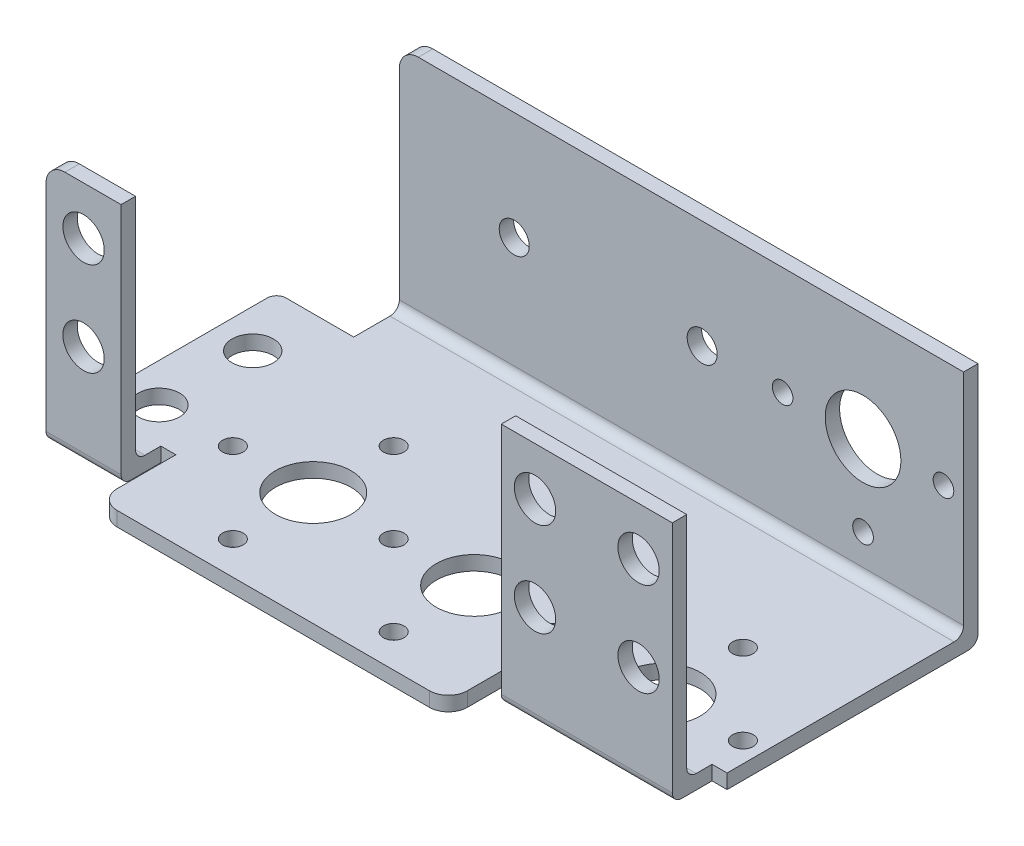
from build123d import *

# Parameters (mm, degrees)
SKETCH1_W                = 114.3
SKETCH1_H                = 34.72
BOSS_EXTRUDE1_DEPTH      = 1.524
SKETCH2_R                = 2.184
SKETCH2_W                = 8.15
SKETCH2_H                = 6.35
CUT_EXTRUDE1_DEPTH       = 1.524
SKETCH3_R                = 4
CUT_EXTRUDE2_DEPTH       = 50
SKETCH4_R                = 1.09
CUT_EXTRUDE3_DEPTH       = 50
CIRPATTERN1_COUNT        = 4
MIRROR2_COPY_1_SKETCH_R  = 1.09
MIRROR2_COPY_1_DEPTH     = 50
MIRROR2_COPY_2_SKETCH_R  = 1.09
MIRROR2_COPY_2_DEPTH     = 50
MIRROR2_COPY_3_SKETCH_R  = 1.09
MIRROR2_COPY_3_DEPTH     = 50
SKETCH7_R                = 4
CUT_EXTRUDE4_DEPTH       = 100
SKETCH8_R                = 1.09
CUT_EXTRUDE5_DEPTH       = 100
CIRPATTERN2_COUNT        = 4
SKETCH9_W                = 7.9375
SKETCH9_H                = 1.524
BOSS_EXTRUDE2_DEPTH      = 24.2
SKETCH10_W               = 98
SKETCH10_H               = 1.524
SKETCH10_W_2             = 18.075
BOSS_EXTRUDE3_DEPTH      = 24.2
SKETCH11_R               = 2.1844
CUT_EXTRUDE6_DEPTH       = 24.2
SKETCH12_R               = 2.1844
CUT_EXTRUDE8_DEPTH       = 24.2
FILLET1_R                = 1
SKETCH13_R               = 1.5875
CUT_EXTRUDE9_DEPTH       = 24.2
FILLET2_R                = 2
SKETCH14_R               = 4
CUT_EXTRUDE10_DEPTH      = 24.2
SKETCH15_R               = 1.09
CUT_EXTRUDE11_DEPTH      = 24.2
CIRPATTERN3_COUNT        = 4
CUT_EXTRUDE13_DEPTH      = 30
CUT_EXTRUDE13_DEPTH_BACK = 19
SKETCH18_W               = 48.234659097
SKETCH18_H               = 11.142394616
SKETCH18_H_2             = 30.082733934


with BuildPart() as part:
    # Sketch1 → Boss-Extrude1 (new body)
    with BuildSketch(Plane(origin=(0, 0, 0), x_dir=(1, 0, 0), z_dir=(0, 1, 0))):
        Rectangle(SKETCH1_W, SKETCH1_H)
    extrude(amount=BOSS_EXTRUDE1_DEPTH)

    # Sketch2 → Cut-Extrude1 (cut)
    with BuildSketch(Plane(origin=(0, 1.524, 0), x_dir=(1, 0, 0), z_dir=(0, 1, 0))):
        with Locations(Location((-53.075, 4.41, 0), (0, 0, 270))):
            Circle(SKETCH2_R)
        with Locations(Location((-53.075, -5.5, 0), (0, 0, 270))):
            Circle(SKETCH2_R)
        with Locations((-53.075, 14.185)):
            Rectangle(SKETCH2_W, SKETCH2_H)
        Polygon((-57.15, -13.36), (-49.2125, -13.36), (-49.2125, -9.16), (-47.625, -9.16), (-47.625, -13.36), (-47.625, -17.36), (-57.15, -17.36), align=None)
        Polygon((-10.625, -13.36), (-10.625, -9.16), (-9.0375, -9.16), (-9.0375, -13.36), (0, -13.36), (0, -17.36), (-10.625, -17.36), align=None)
    cut_extrude1 = extrude(amount=-CUT_EXTRUDE1_DEPTH, mode=Mode.SUBTRACT)

    # Mirror1: Cut-Extrude1 across plane
    add(cut_extrude1.mirror(Plane(origin=(0, 0, 0), x_dir=(0, 0, 1), z_dir=(1, 0, 0))), mode=Mode.SUBTRACT)

    # Sketch3 → Cut-Extrude2 (cut, symmetric)
    with BuildSketch(Plane(origin=(0, 1.524, 0), x_dir=(1, 0, 0), z_dir=(0, 1, 0))):
        with Locations(Location((-36.9062, -5.36, 0), (0, 0, 90))):
            Circle(SKETCH3_R)
    cut_extrude2 = extrude(amount=CUT_EXTRUDE2_DEPTH, both=True, mode=Mode.SUBTRACT)

    # Sketch4 → Cut-Extrude3 (cut, symmetric)
    with BuildSketch(Plane(origin=(0, 1.524, 0), x_dir=(1, 0, 0), z_dir=(0, 1, 0))):
        with Locations(Location((-36.9062, 3.14, 0), (0, 0, 90))):
            Circle(SKETCH4_R)
    cut_extrude3 = extrude(amount=CUT_EXTRUDE3_DEPTH, both=True, mode=Mode.SUBTRACT)

    # CirPattern1: Cut-Extrude3 ×4 about axis
    cirpattern1_axis = Axis((-36.9062, 0, 5.36), (0, 1, 0))
    for i in range(1, CIRPATTERN1_COUNT):
        add(cut_extrude3.rotate(cirpattern1_axis, i * 360 / CIRPATTERN1_COUNT), mode=Mode.SUBTRACT)

    # Mirror2: Cut-Extrude2, Cut-Extrude3 across plane
    add(cut_extrude2.mirror(Plane.ZY.offset(28.4062)), mode=Mode.SUBTRACT)
    add(cut_extrude3.mirror(Plane.ZY.offset(28.4062)), mode=Mode.SUBTRACT)

    # Mirror2 copy 1 sketch → Mirror2 copy 1 (cut, symmetric)
    with BuildSketch(Plane(origin=(-14.5462, 1.524, -31.5462), x_dir=(0, 0, -1), z_dir=(0, 1, 0))):
        with Locations((-36.9062, -3.14)):
            Circle(MIRROR2_COPY_1_SKETCH_R)
    extrude(amount=MIRROR2_COPY_1_DEPTH, both=True, mode=Mode.SUBTRACT)

    # Mirror2 copy 2 sketch → Mirror2 copy 2 (cut, symmetric)
    with BuildSketch(Plane(origin=(17, 1.524, 10.72), x_dir=(1, 0, 0), z_dir=(0, 1, 0))):
        with Locations((-36.9062, -3.14)):
            Circle(MIRROR2_COPY_2_SKETCH_R)
    extrude(amount=MIRROR2_COPY_2_DEPTH, both=True, mode=Mode.SUBTRACT)

    # Mirror2 copy 3 sketch → Mirror2 copy 3 (cut, symmetric)
    with BuildSketch(Plane(origin=(-25.2662, 1.524, 42.2662), x_dir=(0, 0, 1), z_dir=(0, 1, 0))):
        with Locations((-36.9062, -3.14)):
            Circle(MIRROR2_COPY_3_SKETCH_R)
    extrude(amount=MIRROR2_COPY_3_DEPTH, both=True, mode=Mode.SUBTRACT)

    # Sketch7 → Cut-Extrude4 (cut)
    with BuildSketch(Plane(origin=(0, 1.524, 0), x_dir=(1, 0, 0), z_dir=(0, 1, 0))):
        with Locations(Location((0, -5.36, 0), (0, 0, 270))):
            Circle(SKETCH7_R)
    extrude(amount=-CUT_EXTRUDE4_DEPTH, mode=Mode.SUBTRACT)

    # Sketch8 → Cut-Extrude5 (cut)
    with BuildSketch(Plane(origin=(0, 1.524, 0), x_dir=(1, 0, 0), z_dir=(0, 1, 0))):
        with Locations(Location((0, 3.14, 0), (0, 0, 270))):
            Circle(SKETCH8_R)
    cut_extrude5 = extrude(amount=-CUT_EXTRUDE5_DEPTH, mode=Mode.SUBTRACT)

    # CirPattern2: Cut-Extrude5 ×4 about axis, 1 skipped
    cirpattern2_axis = Axis((0, 0, 5.36), (0, 1, 0))
    add([cut_extrude5.rotate(cirpattern2_axis, i * 360 / CIRPATTERN2_COUNT) for i in range(1, CIRPATTERN2_COUNT) if i not in (2,)], mode=Mode.SUBTRACT)

    # Sketch9 → Boss-Extrude2 (add)
    with BuildSketch(Plane(origin=(0, 1.524, 0), x_dir=(1, 0, 0), z_dir=(0, 1, 0))):
        with Locations((-53.18125, -12.598)):
            Rectangle(SKETCH9_W, SKETCH9_H)
    boss_extrude2 = extrude(amount=BOSS_EXTRUDE2_DEPTH)

    # Mirror4: Boss-Extrude2 across plane
    add(boss_extrude2.mirror(Plane(origin=(0, 0, 0), x_dir=(0, 0, 1), z_dir=(1, 0, 0))))

    # Sketch10 → Boss-Extrude3 (add)
    with BuildSketch(Plane(origin=(0, 1.524, 0), x_dir=(1, 0, 0), z_dir=(0, 1, 0))):
        with Locations((0, 16.598)):
            Rectangle(SKETCH10_W, SKETCH10_H)
        with Locations((0, -12.598)):
            Rectangle(SKETCH10_W_2, SKETCH10_H)
    extrude(amount=BOSS_EXTRUDE3_DEPTH)

    # Sketch11 → Cut-Extrude6 (cut)
    with BuildSketch(Plane.XY.offset(13.36)):
        with Locations((-53.18125, 20.644)):
            Circle(SKETCH11_R)
        with Locations((-53.18125, 10.734)):
            Circle(SKETCH11_R)
    cut_extrude6 = extrude(amount=-CUT_EXTRUDE6_DEPTH, mode=Mode.SUBTRACT)

    # Mirror5: Cut-Extrude6 across plane
    add(cut_extrude6.mirror(Plane(origin=(0, 0, 0), x_dir=(0, 0, 1), z_dir=(1, 0, 0))), mode=Mode.SUBTRACT)

    # Sketch12 → Cut-Extrude8 (cut)
    with BuildSketch(Plane.XY.offset(13.36)):
        with Locations((-5.47125, 20.644)):
            Circle(SKETCH12_R)
        with Locations((-5.47125, 10.734)):
            Circle(SKETCH12_R)
        with Locations((5.47125, 10.734)):
            Circle(SKETCH12_R)
        with Locations((5.47125, 20.644)):
            Circle(SKETCH12_R)
    extrude(amount=-CUT_EXTRUDE8_DEPTH, mode=Mode.SUBTRACT)

    # Fillet1
    fillet1_edges = [part.edges().sort_by_distance(p)[0] for p in [
        (53.18125, 0, 13.36),
        (-53.18125, 1.524, 11.836),
        (53.18125, 1.524, 11.836),
        (0, 1.524, -15.836),
        (0, 1.524, 11.836),
        (-57.15, 0.762, -11.01),
        (-53.18125, 0, 13.36),
        (0, 0, 13.36),
        (0, 0, -17.36),
        (57.15, 0.762, -11.01),
    ]]
    fillet(fillet1_edges, radius=FILLET1_R)

    # Sketch13 → Cut-Extrude9 (cut)
    with BuildSketch(Plane.XY.offset(-15.836)):
        with Locations((36.8628, 14.2875)):
            Circle(SKETCH13_R)
        with Locations((17, 14.2875)):
            Circle(SKETCH13_R)
    cut_extrude9 = extrude(amount=-CUT_EXTRUDE9_DEPTH, mode=Mode.SUBTRACT)

    # Mirror6: Cut-Extrude9 across plane
    add(cut_extrude9.mirror(Plane(origin=(0, 0, 0), x_dir=(0, 0, 1), z_dir=(1, 0, 0))), mode=Mode.SUBTRACT)

    # Fillet2
    fillet2_edges = [part.edges().sort_by_distance(p)[0] for p in [
        (47.625, 0.762, 17.36),
        (10.625, 0.762, 17.36),
        (-57.15, 25.724, 12.598),
        (57.15, 25.724, 12.598),
        (-49, 25.724, -16.598),
        (49, 25.724, -16.598),
        (-47.625, 0.762, 17.36),
        (-10.625, 0.762, 17.36),
    ]]
    fillet(fillet2_edges, radius=FILLET2_R)

    # Sketch14 → Cut-Extrude10 (cut)
    with BuildSketch(Plane.XY.offset(-15.836)):
        with Locations((0, 14.2875)):
            Circle(SKETCH14_R)
    extrude(amount=-CUT_EXTRUDE10_DEPTH, mode=Mode.SUBTRACT)

    # Sketch15 → Cut-Extrude11 (cut)
    with BuildSketch(Plane.XY.offset(-15.836)):
        with Locations((0, 5.7875)):
            Circle(SKETCH15_R)
    cut_extrude11 = extrude(amount=-CUT_EXTRUDE11_DEPTH, mode=Mode.SUBTRACT)

    # CirPattern3: Cut-Extrude11 ×4 about axis, 1 skipped
    cirpattern3_axis = Axis((0, 14.2875, 0), (0, 0, 1))
    add([cut_extrude11.rotate(cirpattern3_axis, i * 360 / CIRPATTERN3_COUNT) for i in range(1, CIRPATTERN3_COUNT) if i not in (2,)], mode=Mode.SUBTRACT)

    # Sketch18 → Cut-Extrude13 (cut, two sides: drawn at the far end of the back side and taken through both)
    with BuildSketch(Plane(origin=(0, 1.524, 0), x_dir=(1, 0, 0), z_dir=(0, 1, 0)).offset(-CUT_EXTRUDE13_DEPTH_BACK)):
        with Locations((34.742329549, -14.731197308)):
            Rectangle(SKETCH18_W, SKETCH18_H)
        with Locations((34.742329549, 5.881366967)):
            Rectangle(SKETCH18_W, SKETCH18_H_2)
    extrude(amount=CUT_EXTRUDE13_DEPTH + CUT_EXTRUDE13_DEPTH_BACK, mode=Mode.SUBTRACT)


solid = part.part
